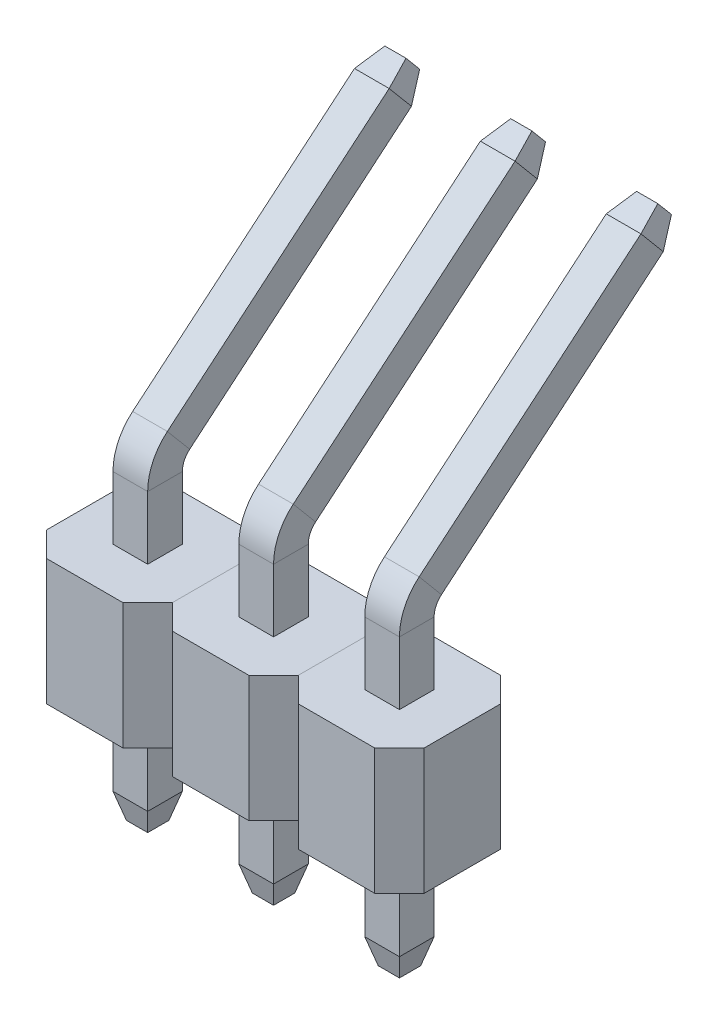
from build123d import *

# Parameters (mm, degrees)
SKETCH3_W           = 2.54
SKETCH3_H           = 2.54
SKETCH3_W_2         = 0.635
SKETCH3_H_2         = 0.635
BOSS_EXTRUDE1_DEPTH = 1.27
CHAMFER1_SIZE       = 0.5
SKETCH5_W           = 0.7
SKETCH5_H           = 0.7
SKETCH10_W          = 0.7
SKETCH10_H          = 0.7
BOSS_EXTRUDE5_DEPTH = 0.508
BOSS_EXTRUDE5_TAPER = 15
SKETCH11_W          = 0.7
SKETCH11_H          = 0.7
BOSS_EXTRUDE6_DEPTH = 0.508
BOSS_EXTRUDE6_TAPER = 15
LPATTERN1_COUNT     = 3
LPATTERN1_PITCH     = 2.54


with BuildPart() as part:
    # Sketch3 → Boss-Extrude1 (new, symmetric)
    with BuildSketch(Plane(origin=(0, 0, 0), x_dir=(1, 0, 0), z_dir=(0, 1, 0))):
        Rectangle(SKETCH3_W, SKETCH3_H)
        Rectangle(SKETCH3_W_2, SKETCH3_H_2, mode=Mode.SUBTRACT)
    extrude(amount=BOSS_EXTRUDE1_DEPTH, both=True)

    # Chamfer1
    chamfer1_edges = [part.edges().sort_by_distance(p)[0] for p in [
        (1.27, 0, 1.27),
        (-1.27, 0, 1.27),
        (-1.27, 0, -1.27),
        (1.27, 0, -1.27),
    ]]
    chamfer(chamfer1_edges, length=CHAMFER1_SIZE)


with BuildPart() as body_2:
    # Sweep1: sweep along a path in Sketch9
    with BuildLine(Plane(origin=(0, 0, 0), x_dir=(0, 0, -1), z_dir=(1, 0, 0))) as sweep1_path:
        Line((0, -3.048), (0, 2.54))
        ThreePointArc((0, 2.54), (0.071393466, 2.862035115), (0.272195841, 3.123725866))
        Line((0.272195841, 3.123725866), (4.747427478, 6.878891081))
    # Sketch5 → Sweep1 (sweep)
    with BuildSketch(Plane(origin=(0, 1.27, 0), x_dir=(1, 0, 0), z_dir=(0, 1, 0))):
        Rectangle(SKETCH5_W, SKETCH5_H)
    sweep(path=sweep1_path.line)

    # Sketch10 → Boss-Extrude5 (add)
    with BuildSketch(Plane(origin=(0, 5.179843784, -6.173097439), x_dir=(1, 0, 0), z_dir=(0, 0.6427876096865378, -0.7660444431189793))):
        with Locations((0, -2.217948727)):
            Rectangle(SKETCH10_W, SKETCH10_H)
    extrude(amount=BOSS_EXTRUDE5_DEPTH, taper=BOSS_EXTRUDE5_TAPER)

    # Sketch11 → Boss-Extrude6 (add)
    with BuildSketch(Plane.XZ.offset(3.048)):
        Rectangle(SKETCH11_W, SKETCH11_H)
    extrude(amount=BOSS_EXTRUDE6_DEPTH, taper=BOSS_EXTRUDE6_TAPER)


with BuildPart() as lpattern1_1:
    # LPattern1: pattern copy
    add(part.part.moved(Location(Vector(1, 0, 0) * (1 * LPATTERN1_PITCH))))


with BuildPart() as lpattern1_2:
    # LPattern1: pattern copy
    add(part.part.moved(Location(Vector(1, 0, 0) * (2 * LPATTERN1_PITCH))))


with BuildPart() as lpattern1_3:
    # LPattern1: pattern copy
    add(body_2.part.moved(Location(Vector(1, 0, 0) * (1 * LPATTERN1_PITCH))))


with BuildPart() as lpattern1_4:
    # LPattern1: pattern copy
    add(body_2.part.moved(Location(Vector(1, 0, 0) * (2 * LPATTERN1_PITCH))))


solid = Compound([part.part, body_2.part, lpattern1_1.part, lpattern1_2.part, lpattern1_3.part, lpattern1_4.part])
